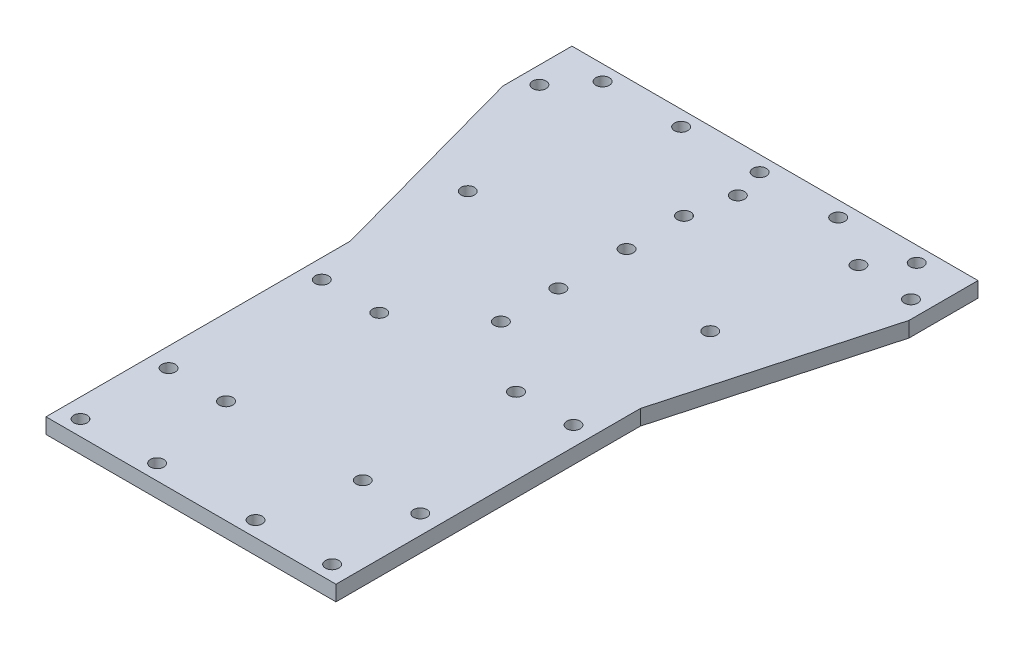
from build123d import *

# Parameters (mm, degrees)
SKETCH1_W           = 75.7
SKETCH1_H           = 42.7
SKETCH1_R           = 1.75
BOSS_EXTRUDE1_DEPTH = 4
SKETCH3_W           = 75.7
SKETCH3_H           = 29.75
SKETCH3_R           = 1.75
BOSS_EXTRUDE2_DEPTH = 4
SKETCH3_3_R         = 1.75
CUT_EXTRUDE1_DEPTH  = 4
SKETCH4_W           = 75.7
SKETCH4_H           = 50
SKETCH4_R           = 1.75
BOSS_EXTRUDE3_DEPTH = 4
SKETCH6_W           = 9
SKETCH6_H           = 8
BOSS_EXTRUDE4_DEPTH = 4
SKETCH6_3_R         = 1.75
CUT_EXTRUDE2_DEPTH  = 115.220007004
SKETCH7_W           = 15.15
SKETCH7_H           = 10
SKETCH7_R           = 1.75
BOSS_EXTRUDE5_DEPTH = 4
SKETCH8_W           = 75.7
SKETCH8_H           = 22
BOSS_EXTRUDE6_DEPTH = 4
SKETCH9_R           = 1.75
CUT_EXTRUDE3_DEPTH  = 135.08433913
BOSS_EXTRUDE7_DEPTH = 4


with BuildPart() as part:
    # Sketch1 → Boss-Extrude1 (new body)
    with BuildSketch(Plane(origin=(0, 0, 0), x_dir=(1, 0, 0), z_dir=(0, 1, 0))):
        Rectangle(SKETCH1_W, SKETCH1_H)
        with Locations(Location((2.4, 17.25, 0), (0, 0, 270))):
            Circle(SKETCH1_R, mode=Mode.SUBTRACT)
        with Locations(Location((-33.8, -17.05, 0), (0, 0, 270))):
            Circle(SKETCH1_R, mode=Mode.SUBTRACT)
        with Locations(Location((29.5, -17.05, 0), (0, 0, 270))):
            Circle(SKETCH1_R, mode=Mode.SUBTRACT)
        with Locations(Location((33.9, 17.25, 0), (0, 0, 270))):
            Circle(SKETCH1_R, mode=Mode.SUBTRACT)
    extrude(amount=BOSS_EXTRUDE1_DEPTH)

    # Sketch3 → Boss-Extrude2 (add)
    with BuildSketch(Plane(origin=(0, 4, 0), x_dir=(1, 0, 0), z_dir=(0, 1, 0))):
        with Locations((0, -36.225)):
            Rectangle(SKETCH3_W, SKETCH3_H)
        with Locations(Location((0, -42.2, 0), (0, 0, 270))):
            Circle(SKETCH3_R, mode=Mode.SUBTRACT)
        with Locations(Location((0, -27.2, 0), (0, 0, 270))):
            Circle(SKETCH3_R, mode=Mode.SUBTRACT)
    extrude(amount=-BOSS_EXTRUDE2_DEPTH)

    # Sketch3<3> → Cut-Extrude1 (cut)
    with BuildSketch(Plane(origin=(0, 4, 0), x_dir=(1, 0, 0), z_dir=(0, 1, 0))):
        with Locations(Location((0, 5.6, 0), (0, 0, 270))):
            Circle(SKETCH3_3_R)
        with Locations(Location((0, -9.4, 0), (0, 0, 270))):
            Circle(SKETCH3_3_R)
    extrude(amount=-CUT_EXTRUDE1_DEPTH, mode=Mode.SUBTRACT)

    # Sketch4 → Boss-Extrude3 (add)
    # profile 1 of 2: a face of its own
    with BuildSketch(Plane(origin=(0, 0, 0), x_dir=(1, 0, 0), z_dir=(0, 1, 0))):
        with Locations((0, -76.1)):
            Rectangle(SKETCH4_W, SKETCH4_H)
        with Locations(Location((-32.85, -56.1, 0), (0, 0, 270))):
            Circle(SKETCH4_R, mode=Mode.SUBTRACT)
        with Locations(Location((-17.85, -56.1, 0), (0, 0, 270))):
            Circle(SKETCH4_R, mode=Mode.SUBTRACT)
        with Locations(Location((-17.85, -96.1, 0), (0, 0, 270))):
            Circle(SKETCH4_R, mode=Mode.SUBTRACT)
        with Locations(Location((-32.85, -96.1, 0), (0, 0, 270))):
            Circle(SKETCH4_R, mode=Mode.SUBTRACT)
        with Locations(Location((32.85, -96.1, 0), (0, 0, 90))):
            Circle(SKETCH4_R, mode=Mode.SUBTRACT)
        with Locations(Location((17.85, -96.1, 0), (0, 0, 90))):
            Circle(SKETCH4_R, mode=Mode.SUBTRACT)
        with Locations(Location((17.85, -56.1, 0), (0, 0, 90))):
            Circle(SKETCH4_R, mode=Mode.SUBTRACT)
        with Locations(Location((32.85, -56.1, 0), (0, 0, 90))):
            Circle(SKETCH4_R, mode=Mode.SUBTRACT)
    # profile 2 of 2: a face of its own
    with BuildSketch(Plane(origin=(0, 0, 0), x_dir=(1, 0, 0), z_dir=(0, 1, 0))):
        Polygon((-37.85, 21.35), (-44, 21.35), (-44, 29.35), (44, 29.35), (44, 21.35), (37.85, 21.35), align=None)
    extrude(amount=BOSS_EXTRUDE3_DEPTH)

    # Sketch6 → Boss-Extrude4 (add)
    with BuildSketch(Plane(origin=(0, 4, 0), x_dir=(1, 0, 0), z_dir=(0, 1, 0))):
        with Locations((-48.5, 25.35)):
            Rectangle(SKETCH6_W, SKETCH6_H)
        with Locations((48.5, 25.35)):
            Rectangle(SKETCH6_W, SKETCH6_H)
    extrude(amount=-BOSS_EXTRUDE4_DEPTH)

    # Sketch6<3> → Cut-Extrude2 (cut, through all)
    with BuildSketch(Plane(origin=(0, 4, 0), x_dir=(1, 0, 0), z_dir=(0, 1, 0))):
        with Locations(Location((0, 25.35, 0), (0, 0, 270))):
            Circle(SKETCH6_3_R)
        with Locations(Location((20.5, 25.35, 0), (0, 0, 270))):
            Circle(SKETCH6_3_R)
        with Locations(Location((41, 25.35, 0), (0, 0, 270))):
            Circle(SKETCH6_3_R)
        with Locations(Location((-20.5, 25.35, 0), (0, 0, 270))):
            Circle(SKETCH6_3_R)
        with Locations(Location((-41, 25.35, 0), (0, 0, 270))):
            Circle(SKETCH6_3_R)
    extrude(amount=-CUT_EXTRUDE2_DEPTH, mode=Mode.SUBTRACT)

    # Sketch7 → Boss-Extrude5 (add)
    # profile 1 of 2: a face of its own
    with BuildSketch(Plane(origin=(0, 0, 0), x_dir=(1, 0, 0), z_dir=(0, 1, 0))):
        with Locations((-45.425, 16.35)):
            Rectangle(SKETCH7_W, SKETCH7_H)
        with Locations(Location((-48.5, 16.35, 0), (0, 0, 270))):
            Circle(SKETCH7_R, mode=Mode.SUBTRACT)
    # profile 2 of 2: a face of its own
    with BuildSketch(Plane(origin=(0, 0, 0), x_dir=(1, 0, 0), z_dir=(0, 1, 0))):
        with Locations((45.425, 16.35)):
            Rectangle(SKETCH7_W, SKETCH7_H)
        with Locations(Location((48.5, 16.35, 0), (0, 0, 270))):
            Circle(SKETCH7_R, mode=Mode.SUBTRACT)
    extrude(amount=BOSS_EXTRUDE5_DEPTH)

    # Sketch8 → Boss-Extrude6 (add)
    with BuildSketch(Plane(origin=(0, 0, 0), x_dir=(1, 0, 0), z_dir=(0, 1, 0))):
        with Locations((0, -112.1)):
            Rectangle(SKETCH8_W, SKETCH8_H)
    extrude(amount=BOSS_EXTRUDE6_DEPTH)

    # Sketch9 → Cut-Extrude3 (cut, through all)
    with BuildSketch(Plane(origin=(0, 4, 0), x_dir=(1, 0, 0), z_dir=(0, 1, 0))):
        with Locations(Location((-12.85, -119.1, 0), (0, 0, 270))):
            Circle(SKETCH9_R)
        with Locations(Location((-32.85, -119.1, 0), (0, 0, 270))):
            Circle(SKETCH9_R)
    cut_extrude3 = extrude(amount=-CUT_EXTRUDE3_DEPTH, mode=Mode.SUBTRACT)

    # Mirror1: Cut-Extrude3 across plane
    add(cut_extrude3.mirror(Plane(origin=(0, 0, 0), x_dir=(0, 0, 1), z_dir=(1, 0, 0))), mode=Mode.SUBTRACT)

    # Sketch10 → Boss-Extrude7 (add)
    with BuildSketch(Plane(origin=(0, 4, 0), x_dir=(1, 0, 0), z_dir=(0, 1, 0))):
        Polygon((-53, 11.35), (-37.85, -43.65), (-37.85, 11.35), align=None)
        Polygon((53, 11.35), (37.85, -43.65), (37.85, 11.35), align=None)
    extrude(amount=-BOSS_EXTRUDE7_DEPTH)


solid = part.part
